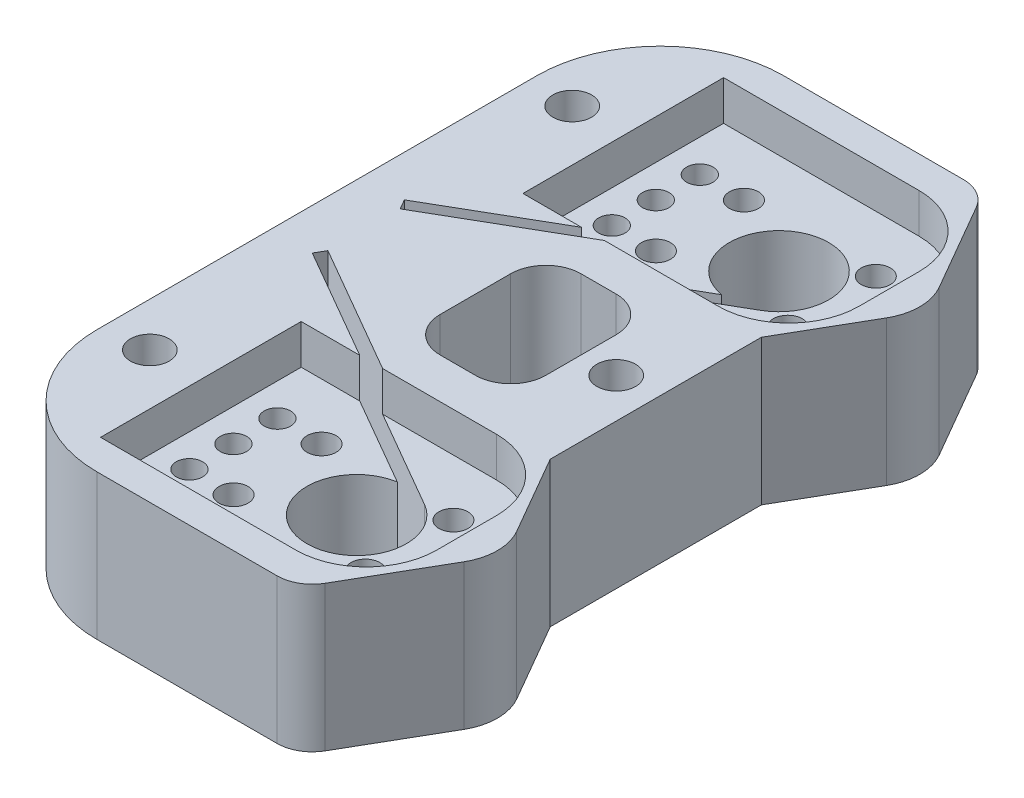
from build123d import *
from build123d.topology import SkipClean

# Parameters (mm, degrees)
SKETCH1_W                  = 22
SKETCH1_H                  = 39
SKETCH1_W_2                = 6
SKETCH1_H_2                = 8
BOSS_EXTRUDE1_DEPTH        = 8.25
SKETCH8_W                  = 15.1
SKETCH8_H                  = 11.4
CUT_EXTRUDE3_DEPTH         = 2.25
SKETCH7_R                  = 2.825
SKETCH7_R_2                = 0.825
CUT_EXTRUDE4_DEPTH         = 1.25
SKETCH9_R                  = 0.75
CUT_EXTRUDE5_DEPTH         = 39.274404999
CUT_EXTRUDE1_DEPTH         = 37.440988331
CUT_EXTRUDE1_DEPTH_BACK    = 39.690988331
CUT_EXTRUDE1_START         = 2.25
SKETCH6_R                  = 2.825
BOSS_EXTRUDE2_DEPTH        = 8.25
FILLET3_R                  = 4
FILLET4_R                  = 2
CUT_EXTRUDE7_DEPTH         = 39.900472274
FILLET5_R                  = 7
F_2_2_2_2_DIAMETER_HOLE1_D = 2.2
FILLET6_R                  = 2


with BuildPart() as part:
    # Sketch1 → Boss-Extrude1 (new body)
    with BuildSketch(Plane(origin=(0, 0, 0), x_dir=(1, 0, 0), z_dir=(0, 1, 0))):
        with Locations((21.383330249, 0)):
            Rectangle(SKETCH1_W, SKETCH1_H)
        with Locations((22.383330249, 0)):
            Rectangle(SKETCH1_W_2, SKETCH1_H_2, mode=Mode.SUBTRACT)
    extrude(amount=BOSS_EXTRUDE1_DEPTH)

    # Sketch8 → Cut-Extrude3 (cut)
    with BuildSketch(Plane(origin=(0, 8.25, 0), x_dir=(1, 0, 0), z_dir=(0, 1, 0))):
        with Locations((23.333330249, -12)):
            Rectangle(SKETCH8_W, SKETCH8_H)
        with Locations((23.333330249, 12)):
            Rectangle(SKETCH8_W, SKETCH8_H)
    extrude(amount=-CUT_EXTRUDE3_DEPTH, mode=Mode.SUBTRACT)

    # Sketch7 → Cut-Extrude4 (cut)
    with BuildSketch(Plane(origin=(0, 6, 0), x_dir=(1, 0, 0), z_dir=(0, 1, 0))):
        with Locations(Location((24.633330249, 12, 0), (0, 0, 270))):
            Circle(SKETCH7_R)
        with Locations(Location((20.140330249, 14.5, 0), (0, 0, 270))):
            Circle(SKETCH7_R_2)
        with Locations(Location((27.633330249, 14.5, 0), (0, 0, 270))):
            Circle(SKETCH7_R_2)
        with Locations(Location((27.633330249, 9.5, 0), (0, 0, 270))):
            Circle(SKETCH7_R_2)
        with Locations(Location((20.140330249, 9.5, 0), (0, 0, 270))):
            Circle(SKETCH7_R_2)
        with Locations(Location((20.140330249, -9.5, 0), (0, 0, 90))):
            Circle(SKETCH7_R_2)
        with Locations(Location((27.633330249, -9.5, 0), (0, 0, 90))):
            Circle(SKETCH7_R_2)
        with Locations(Location((27.633330249, -14.5, 0), (0, 0, 90))):
            Circle(SKETCH7_R_2)
        with Locations(Location((20.140330249, -14.5, 0), (0, 0, 90))):
            Circle(SKETCH7_R_2)
        with Locations(Location((24.633330249, -12, 0), (0, 0, 90))):
            Circle(SKETCH7_R)
    extrude(amount=-CUT_EXTRUDE4_DEPTH, mode=Mode.SUBTRACT)

    # Sketch9 → Cut-Extrude5 (cut, through all)
    with BuildSketch(Plane(origin=(0, 6, 0), x_dir=(1, 0, 0), z_dir=(0, 1, 0))):
        with Locations(Location((17.633330249, 14.5, 0), (0, 0, 270))):
            Circle(SKETCH9_R)
        with Locations(Location((17.633330249, 12, 0), (0, 0, 270))):
            Circle(SKETCH9_R)
        with Locations(Location((17.633330249, 9.5, 0), (0, 0, 270))):
            Circle(SKETCH9_R)
        with Locations(Location((30.133330249, 12, 0), (0, 0, 270))):
            Circle(SKETCH9_R)
        with Locations((30.133330249, -12)):
            Circle(SKETCH9_R)
        with Locations(Location((17.633330249, -9.5, 0), (0, 0, 90))):
            Circle(SKETCH9_R)
        with Locations(Location((17.633330249, -12, 0), (0, 0, 90))):
            Circle(SKETCH9_R)
        with Locations(Location((17.633330249, -14.5, 0), (0, 0, 90))):
            Circle(SKETCH9_R)
    extrude(amount=-CUT_EXTRUDE5_DEPTH, mode=Mode.SUBTRACT)

    # Sketch6 → Cut-Extrude1 (cut, two sides: drawn at the far end of the back side and taken through both)
    with BuildSketch(Plane(origin=(0, 8.25, 0), x_dir=(-1, 0, 0), z_dir=(0, -1, 0)).offset(CUT_EXTRUDE1_START - CUT_EXTRUDE1_DEPTH_BACK)):
        with Locations((-24.633330249, -12)):
            Circle(SKETCH6_R)
        with Locations((-24.633330249, 12)):
            Circle(SKETCH6_R)
        Polygon((-26.045830249, -9.553478234), (-25.720830249, -10.116394747), (-12.730449192, -2.616394747), (-13.055449192, -2.053478234), align=None)
        Polygon((-13.055449192, 2.053478234), (-12.730449192, 2.616394747), (-25.720830249, 10.116394747), (-26.045830249, 9.553478234), align=None)
    extrude(amount=CUT_EXTRUDE1_DEPTH + CUT_EXTRUDE1_DEPTH_BACK, mode=Mode.SUBTRACT)

    # Sketch11 → Boss-Extrude2 (add, through all)
    with BuildSketch(Plane(origin=(0, 8.25, 0), x_dir=(1, 0, 0), z_dir=(0, 1, 0))):
        with BuildLine():
            ThreePointArc((32.383330249, 10.801042119), (32.633330249, 12), (32.383330249, 13.198957881))
            Line((32.383330249, 13.198957881), (32.383330249, 10.801042119))
        make_face()
        with BuildLine():
            ThreePointArc((32.383330249, -13.198957881), (32.633330249, -12), (32.383330249, -10.801042119))
            Line((32.383330249, -10.801042119), (32.383330249, -13.198957881))
        make_face()
    extrude(amount=-BOSS_EXTRUDE2_DEPTH)

    # Fillet3
    fillet3_edges = [part.edges().sort_by_distance(p)[0] for p in [
        (30.883330249, 7.125, -17.7),
        (30.883330249, 7.125, -6.3),
        (30.883330249, 7.125, 6.3),
        (30.883330249, 7.125, 17.7),
    ]]
    fillet(fillet3_edges, radius=FILLET3_R)

    # Fillet4
    fillet4_edges = [part.edges().sort_by_distance(p)[0] for p in [
        (25.383330249, 4.125, -4),
        (19.383330249, 4.125, -4),
        (19.383330249, 4.125, 4),
        (25.383330249, 4.125, 4),
    ]]
    fillet(fillet4_edges, radius=FILLET4_R)

    # Sketch11<4> → Cut-Extrude7 (cut, through all)
    with SkipClean():  # the faces are left unmerged after this step: merging them gives an invalid solid
        with BuildSketch(Plane(origin=(0, 8.25, 0), x_dir=(1, 0, 0), z_dir=(0, 1, 0))):
            with BuildLine():
                Line((28.767304845, 19.5), (29.633330249, 18))
                Line((29.633330249, 18), (29.80653533, 17.7))
                Line((29.80653533, 17.7), (30.883330249, 17.7))
                Line((30.883330249, 17.7), (30.883330249, 15.834936491))
                Line((30.883330249, 15.834936491), (32.231406461, 13.5))
                ThreePointArc((32.231406461, 13.5), (32.311601404, 13.351615189), (32.383330249, 13.198957881))
                Line((32.383330249, 13.198957881), (32.383330249, 19.5))
                Line((32.383330249, 19.5), (28.767304845, 19.5))
            make_face()
            Polygon((30.883330249, 17.7), (29.80653533, 17.7), (30.883330249, 15.834936491), align=None)
            with BuildLine():
                Line((32.383330249, -10.801042119), (32.383330249, 10.801042119))
                ThreePointArc((32.383330249, 10.801042119), (32.311601404, 10.648384811), (32.231406461, 10.5))
                Line((32.231406461, 10.5), (30.883330249, 8.165063509))
                Line((30.883330249, 8.165063509), (30.883330249, 6.3))
                Line((30.883330249, 6.3), (29.80653533, 6.3))
                Line((29.80653533, 6.3), (29.633330249, 6))
                Line((29.633330249, 6), (29.633330249, -6))
                Line((29.633330249, -6), (29.80653533, -6.3))
                Line((29.80653533, -6.3), (30.883330249, -6.3))
                Line((30.883330249, -6.3), (30.883330249, -8.165063509))
                Line((30.883330249, -8.165063509), (32.231406461, -10.5))
                ThreePointArc((32.231406461, -10.5), (32.311601404, -10.648384811), (32.383330249, -10.801042119))
            make_face()
            Polygon((30.883330249, 6.3), (30.883330249, 8.165063509), (29.80653533, 6.3), align=None)
            with BuildLine():
                Line((32.383330249, -19.5), (32.383330249, -13.198957881))
                ThreePointArc((32.383330249, -13.198957881), (32.311601404, -13.351615189), (32.231406461, -13.5))
                Line((32.231406461, -13.5), (30.883330249, -15.834936491))
                Line((30.883330249, -15.834936491), (30.883330249, -17.7))
                Line((30.883330249, -17.7), (29.80653533, -17.7))
                Line((29.80653533, -17.7), (29.633330249, -18))
                Line((29.633330249, -18), (28.767304845, -19.5))
                Line((28.767304845, -19.5), (32.383330249, -19.5))
            make_face()
            Polygon((30.883330249, -17.7), (30.883330249, -15.834936491), (29.80653533, -17.7), align=None)
            Polygon((29.80653533, -6.3), (30.883330249, -8.165063509), (30.883330249, -6.3), align=None)
        extrude(amount=-CUT_EXTRUDE7_DEPTH, mode=Mode.SUBTRACT)

    # Fillet5
    fillet5_edges = [part.edges().sort_by_distance(p)[0] for p in [
        (10.383330249, 4.125, 19.5),
        (10.383330249, 4.125, -19.5),
    ]]
    fillet(fillet5_edges, radius=FILLET5_R)

    # Ø2.2 (2.2) Diameter Hole1 (through all)
    with Locations(Plane(origin=(12.883330249, 8.25, -12), x_dir=(0, 0, 1), z_dir=(0, 1, 0))):
        with Locations((0, 0), (12, 14.5), (24, 0)):
            Hole(F_2_2_2_2_DIAMETER_HOLE1_D / 2)

    # Fillet6
    fillet6_edges = [part.edges().sort_by_distance(p)[0] for p in [
        (28.767304845, 4.125, -19.5),
        (28.767304845, 4.125, 19.5),
    ]]
    fillet(fillet6_edges, radius=FILLET6_R)


solid = part.part
